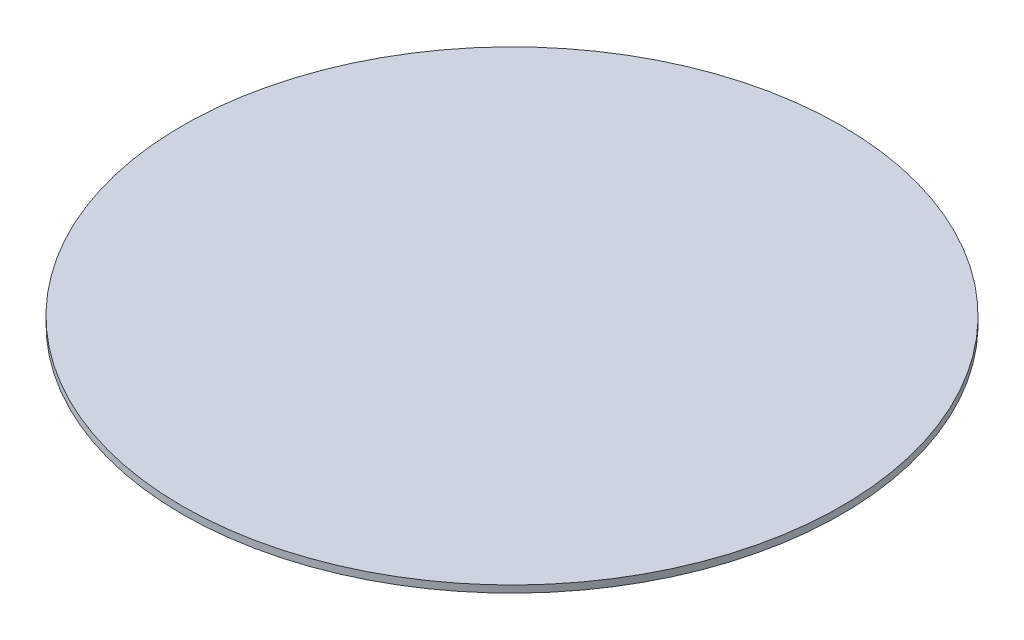
from build123d import *

# Parameters (mm, degrees)
SKETCH1_R           = 140
BOSS_EXTRUDE1_DEPTH = 3


with BuildPart() as part:
    # Sketch1 → Boss-Extrude1 (new body)
    with BuildSketch(Plane(origin=(0, 0, 0), x_dir=(1, 0, 0), z_dir=(0, 1, 0))):
        with Locations(Location((0, 0, 0), (0, 0, 270))):
            Circle(SKETCH1_R)
    extrude(amount=BOSS_EXTRUDE1_DEPTH)


solid = part.part
